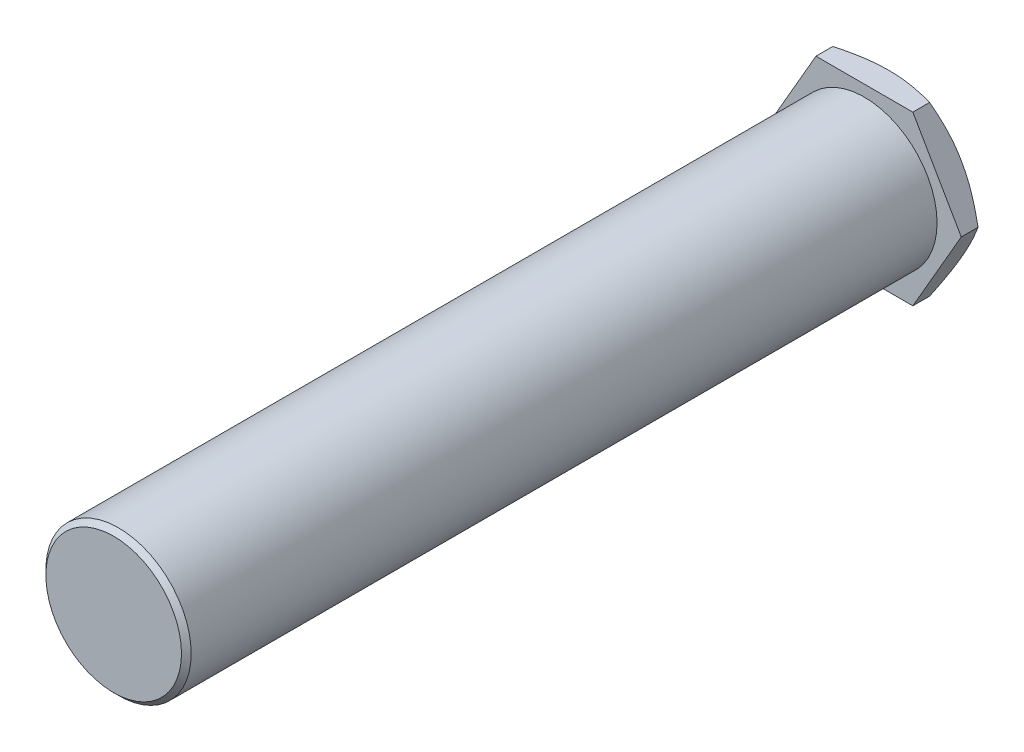
from build123d import *

# Parameters (mm, degrees)
DODANIE_WYCI_GNI_CIE1_DEPTH = 5
SZKIC2_OUTSIDE_W            = 69.95
SZKIC2_OUTSIDE_H            = 64.592
SZKIC2_OUTSIDE_R            = 17.320508076
WYTNIJ_WYCI_GNI_CIE1_DEPTH  = 5
WYTNIJ_WYCI_GNI_CIE1_DRAFT  = 60
SZKIC3_R                    = 15
DODANIE_WYCI_GNI_CIE2_DEPTH = 155
SFAZOWANIE1_SIZE            = 1


with BuildPart() as part:
    # Szkic1 → Dodanie-wyciągnięcie1 (new body)
    with BuildSketch(Plane.XY):
        Polygon((10, 17.320508076), (-10, 17.320508076), (-20, 0), (-10, -17.320508076), (10, -17.320508076), (20, 0), align=None)
    extrude(amount=DODANIE_WYCI_GNI_CIE1_DEPTH)


with BuildPart() as wytnij_wyci_gni_cie1_tool:
    # Szkic2 outside → Wytnij-wyciągnięcie1 (with draft: the straight prism first)
    with BuildSketch(Plane.XY):
        Rectangle(SZKIC2_OUTSIDE_W, SZKIC2_OUTSIDE_H)
        Circle(SZKIC2_OUTSIDE_R, mode=Mode.SUBTRACT)
    extrude(amount=WYTNIJ_WYCI_GNI_CIE1_DEPTH)
    # Wytnij-wyciągnięcie1: the draft: its side faces are tilted about the plane it starts from
    wytnij_wyci_gni_cie1_sides = [wytnij_wyci_gni_cie1_tool.faces().sort_by_distance(p)[0] for p in [
        (0, -32.296, 2.5),
        (34.975, 0, 2.5),
        (0, 32.296, 2.5),
        (-34.975, 0, 2.5),
        (-17.320508076, 0, 2.5),
    ]]
    draft(wytnij_wyci_gni_cie1_sides, Plane.XY, WYTNIJ_WYCI_GNI_CIE1_DRAFT)


with BuildPart() as part_1:
    add(part.part)

    # Wytnij-wyciągnięcie1: cut by wytnij_wyci_gni_cie1_tool
    add(wytnij_wyci_gni_cie1_tool.part, mode=Mode.SUBTRACT)

    # Szkic3 → Dodanie-wyciągnięcie2 (add)
    with BuildSketch(Plane.XY.offset(5)):
        Circle(SZKIC3_R)
    extrude(amount=DODANIE_WYCI_GNI_CIE2_DEPTH)

    # Sfazowanie1
    sfazowanie1_edges = [part_1.edges().sort_by_distance(p)[0] for p in [
        (-15, 0, 160),
    ]]
    chamfer(sfazowanie1_edges, length=SFAZOWANIE1_SIZE)


solid = part_1.part
